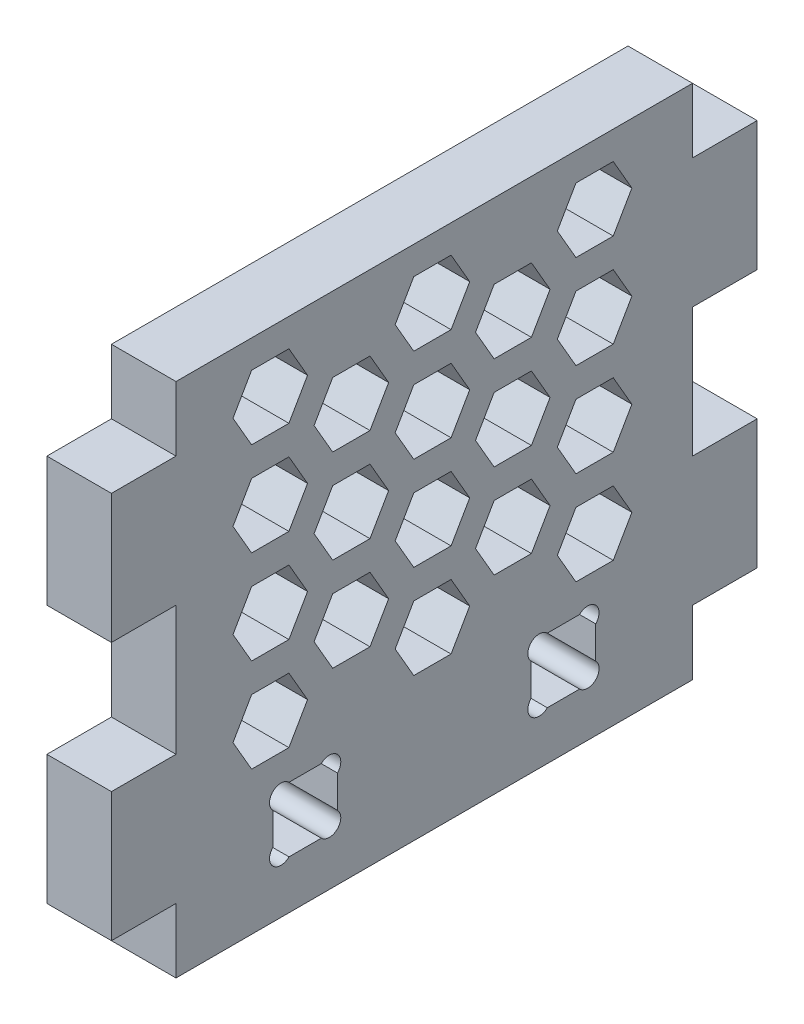
from build123d import *

# Parameters (mm, degrees)
SKETCH3_W                 = 101.6
SKETCH3_H                 = 101.6
SQUARE_EXTRUSION_DEPTH    = 12.7
SKETCH4_R                 = 2.24536
SKETCH4_W                 = 12.7
SKETCH4_H                 = 12.7
SLOTTING_HOLES_DEPTH      = 12.7
HONEYCOMB_POCKETING_DEPTH = 12.7
SKETCH10_W                = 12.7
SKETCH10_H                = 12.7
SIDE_SLOTS_DEPTH          = 12.7


with BuildPart() as part:
    # Sketch3 → Square Extrusion (new body)
    with BuildSketch(Plane(origin=(0, 0, 0), x_dir=(0, 0, -1), z_dir=(1, 0, 0))):
        Rectangle(SKETCH3_W, SKETCH3_H)
    extrude(amount=SQUARE_EXTRUSION_DEPTH)

    # Sketch4 → Slotting Holes (cut)
    with BuildSketch(Plane(origin=(12.7, 0, 0), x_dir=(0, 0, -1), z_dir=(1, 0, 0))):
        with BuildLine():
            ThreePointArc((-28.574581463, -28.575), (-31.750209282, -28.574790718), (-31.75, -31.750418537))
            Line((-31.75, -31.750418537), (-31.75, -28.575))
            Line((-31.75, -28.575), (-28.574581463, -28.575))
        make_face()
        with BuildLine():
            Line((-31.75, -28.575), (-31.75, -31.750418537))
            ThreePointArc((-31.75, -31.750418537), (-29.303101219, -32.236885515), (-27.91714, -30.1625))
            ThreePointArc((-27.91714, -30.1625), (-28.08800123, -29.303374641), (-28.574581463, -28.575))
            Line((-28.574581463, -28.575), (-31.75, -28.575))
        make_face()
        with Locations((-30.1625, -39.6875)):
            Circle(SKETCH4_R)
        with Locations((-20.6375, -39.6875)):
            Circle(SKETCH4_R)
        with Locations((-20.6375, -30.1625)):
            Circle(SKETCH4_R)
        with Locations((-30.1625, -30.1625)):
            Circle(SKETCH4_R)
        with Locations((-25.4, -34.925)):
            Rectangle(SKETCH4_W, SKETCH4_H)
        with BuildLine():
            ThreePointArc((-22.225418537, -28.575), (-22.225209282, -31.750209282), (-19.05, -31.750418537))
            Line((-19.05, -31.750418537), (-19.05, -28.575))
            Line((-19.05, -28.575), (-22.225418537, -28.575))
        make_face()
        with BuildLine():
            Line((-19.05, -28.575), (-19.05, -31.750418537))
            ThreePointArc((-19.05, -31.750418537), (-18.563114485, -31.021898781), (-18.39214, -30.1625))
            ThreePointArc((-18.39214, -30.1625), (-19.778374641, -28.08800123), (-22.225418537, -28.575))
            Line((-22.225418537, -28.575), (-19.05, -28.575))
        make_face()
        with BuildLine():
            Line((-31.75, -38.099581463), (-31.75, -41.275))
            Line((-31.75, -41.275), (-28.574581463, -41.275))
            ThreePointArc((-28.574581463, -41.275), (-28.08800123, -40.546625359), (-27.91714, -39.6875))
            ThreePointArc((-27.91714, -39.6875), (-29.303101219, -37.613114485), (-31.75, -38.099581463))
        make_face()
        with BuildLine():
            Line((-28.574581463, -41.275), (-31.75, -41.275))
            Line((-31.75, -41.275), (-31.75, -38.099581463))
            ThreePointArc((-31.75, -38.099581463), (-31.750209282, -41.275209282), (-28.574581463, -41.275))
        make_face()
        with BuildLine():
            ThreePointArc((-19.05, -38.099581463), (-22.225209282, -38.099790718), (-22.225418537, -41.275))
            Line((-22.225418537, -41.275), (-19.05, -41.275))
            Line((-19.05, -41.275), (-19.05, -38.099581463))
        make_face()
        with BuildLine():
            Line((-19.05, -41.275), (-22.225418537, -41.275))
            ThreePointArc((-22.225418537, -41.275), (-19.778374641, -41.76199877), (-18.39214, -39.6875))
            ThreePointArc((-18.39214, -39.6875), (-18.563114485, -38.828101219), (-19.05, -38.099581463))
            Line((-19.05, -38.099581463), (-19.05, -41.275))
        make_face()
        with BuildLine():
            ThreePointArc((22.88286, -30.1625), (22.71199877, -29.303374641), (22.225418537, -28.575))
            Line((22.225418537, -28.575), (19.05, -28.575))
            Line((19.05, -28.575), (19.05, -31.750418537))
            ThreePointArc((19.05, -31.750418537), (21.496898781, -32.236885515), (22.88286, -30.1625))
        make_face()
        with BuildLine():
            Line((19.05, -28.575), (22.225418537, -28.575))
            ThreePointArc((22.225418537, -28.575), (19.049790718, -28.574790718), (19.05, -31.750418537))
            Line((19.05, -31.750418537), (19.05, -28.575))
        make_face()
        with Locations((30.1625, -30.1625)):
            Circle(SKETCH4_R)
        with Locations((20.6375, -30.1625)):
            Circle(SKETCH4_R)
        with Locations((20.6375, -39.6875)):
            Circle(SKETCH4_R)
        with Locations((30.1625, -39.6875)):
            Circle(SKETCH4_R)
        with Locations((25.4, -34.925)):
            Rectangle(SKETCH4_W, SKETCH4_H)
        with BuildLine():
            Line((31.75, -31.750418537), (31.75, -28.575))
            Line((31.75, -28.575), (28.574581463, -28.575))
            ThreePointArc((28.574581463, -28.575), (28.574790718, -31.750209282), (31.75, -31.750418537))
        make_face()
        with BuildLine():
            Line((28.574581463, -28.575), (31.75, -28.575))
            Line((31.75, -28.575), (31.75, -31.750418537))
            ThreePointArc((31.75, -31.750418537), (32.236885515, -31.021898781), (32.40786, -30.1625))
            ThreePointArc((32.40786, -30.1625), (31.021625359, -28.08800123), (28.574581463, -28.575))
        make_face()
        with BuildLine():
            ThreePointArc((32.40786, -39.6875), (32.236885515, -38.828101219), (31.75, -38.099581463))
            Line((31.75, -38.099581463), (31.75, -41.275))
            Line((31.75, -41.275), (28.574581463, -41.275))
            ThreePointArc((28.574581463, -41.275), (31.021625359, -41.76199877), (32.40786, -39.6875))
        make_face()
        with BuildLine():
            Line((31.75, -41.275), (31.75, -38.099581463))
            ThreePointArc((31.75, -38.099581463), (28.574790718, -38.099790718), (28.574581463, -41.275))
            Line((28.574581463, -41.275), (31.75, -41.275))
        make_face()
        with BuildLine():
            ThreePointArc((22.88286, -39.6875), (21.496898781, -37.613114485), (19.05, -38.099581463))
            Line((19.05, -38.099581463), (19.05, -41.275))
            Line((19.05, -41.275), (22.225418537, -41.275))
            ThreePointArc((22.225418537, -41.275), (22.71199877, -40.546625359), (22.88286, -39.6875))
        make_face()
        with BuildLine():
            Line((19.05, -41.275), (19.05, -38.099581463))
            ThreePointArc((19.05, -38.099581463), (19.049790718, -41.275209282), (22.225418537, -41.275))
            Line((22.225418537, -41.275), (19.05, -41.275))
        make_face()
    extrude(amount=-SLOTTING_HOLES_DEPTH, mode=Mode.SUBTRACT)

    # Sketch9 → Honeycomb Pocketing (cut)
    with BuildSketch(Plane(origin=(12.7, 0, 0), x_dir=(0, 0, -1), z_dir=(1, 0, 0))):
        Polygon((6.96765294, 38.931186014), (3.301476978, 45.281185003), (-4.03087144, 45.28118298), (-7.697043898, 38.931181968), (-4.030867936, 32.58118298), (3.301480483, 32.581185003), align=None)
        Polygon((-24.928062682, 38.931186014), (-28.594238643, 45.281185003), (-35.926587062, 45.28118298), (-39.592759519, 38.931181968), (-35.926583558, 32.58118298), (-28.594235139, 32.581185003), align=None)
        Polygon((38.863368561, 38.931186014), (35.1971926, 45.281185003), (27.864844181, 45.28118298), (24.198671724, 38.931181968), (27.864847685, 32.58118298), (35.197196104, 32.581185003), align=None)
        Polygon((-8.980204871, 29.723686014), (-12.646380832, 36.073685003), (-19.978729251, 36.07368298), (-23.644901708, 29.723681968), (-19.978725747, 23.37368298), (-12.646377328, 23.373685003), align=None)
        Polygon((22.769795129, 29.723686014), (19.103619168, 36.073685003), (11.771270749, 36.07368298), (8.105098292, 29.723681968), (11.771274253, 23.37368298), (19.103622672, 23.373685003), align=None)
        Polygon((-24.928062682, 20.516186014), (-28.594238643, 26.866185003), (-35.926587062, 26.86618298), (-39.592759519, 20.516181968), (-35.926583558, 14.16618298), (-28.594235139, 14.166185003), align=None)
        Polygon((6.96765294, 20.516186014), (3.301476978, 26.866185003), (-4.03087144, 26.86618298), (-7.697043898, 20.516181968), (-4.030867936, 14.16618298), (3.301480483, 14.166185003), align=None)
        Polygon((38.863368561, 20.516186014), (35.1971926, 26.866185003), (27.864844181, 26.86618298), (24.198671724, 20.516181968), (27.864847685, 14.16618298), (35.197196104, 14.166185003), align=None)
        Polygon((-24.928062682, 2.101186014), (-28.594238643, 8.451185003), (-35.926587062, 8.45118298), (-39.592759519, 2.101181968), (-35.926583558, -4.24881702), (-28.594235139, -4.248814997), align=None)
        Polygon((-8.980204871, -7.106313986), (-12.646380832, -0.756314997), (-19.978729251, -0.75631702), (-23.644901708, -7.106318032), (-19.978725747, -13.45631702), (-12.646377328, -13.456314997), align=None)
        Polygon((6.96765294, 2.101186014), (3.301476978, 8.451185003), (-4.03087144, 8.45118298), (-7.697043898, 2.101181968), (-4.030867936, -4.24881702), (3.301480483, -4.248814997), align=None)
        Polygon((22.769795129, -7.106313986), (19.103619168, -0.756314997), (11.771270749, -0.75631702), (8.105098292, -7.106318032), (11.771274253, -13.45631702), (19.103622672, -13.456314997), align=None)
        Polygon((38.863368561, 2.101186014), (35.1971926, 8.451185003), (27.864844181, 8.45118298), (24.198671724, 2.101181968), (27.864847685, -4.24881702), (35.197196104, -4.248814997), align=None)
        Polygon((38.863368561, -16.313813986), (35.1971926, -9.963814997), (27.864844181, -9.96381702), (24.198671724, -16.313818032), (27.864847685, -22.66381702), (35.197196104, -22.663814997), align=None)
        Polygon((6.96765294, -16.313813986), (3.301476978, -9.963814997), (-4.03087144, -9.96381702), (-7.697043898, -16.313818032), (-4.030867936, -22.66381702), (3.301480483, -22.663814997), align=None)
        Polygon((-24.928062682, -16.313813986), (-28.594238643, -9.963814997), (-35.926587062, -9.96381702), (-39.592759519, -16.313818032), (-35.926583558, -22.66381702), (-28.594235139, -22.663814997), align=None)
        Polygon((22.769795129, 11.308686014), (19.103619168, 17.658685003), (11.771270749, 17.65868298), (8.105098292, 11.308681968), (11.771274253, 4.95868298), (19.103622672, 4.958685003), align=None)
        Polygon((-8.980204871, 11.308686014), (-12.646380832, 17.658685003), (-19.978729251, 17.65868298), (-23.644901708, 11.308681968), (-19.978725747, 4.95868298), (-12.646377328, 4.958685003), align=None)
    extrude(amount=-HONEYCOMB_POCKETING_DEPTH, mode=Mode.SUBTRACT)

    # Sketch10 → Side Slots (add)
    with BuildSketch(Plane(origin=(12.7, 0, 0), x_dir=(0, 0, -1), z_dir=(1, 0, 0))):
        with Locations((-57.15, 31.75)):
            Rectangle(SKETCH10_W, SKETCH10_H)
        with Locations((-57.15, 19.05)):
            Rectangle(SKETCH10_W, SKETCH10_H)
        with Locations((-57.15, -19.05)):
            Rectangle(SKETCH10_W, SKETCH10_H)
        with Locations((-57.15, -31.75)):
            Rectangle(SKETCH10_W, SKETCH10_H)
        with Locations((57.15, -19.05)):
            Rectangle(SKETCH10_W, SKETCH10_H)
        with Locations((57.15, -31.75)):
            Rectangle(SKETCH10_W, SKETCH10_H)
        with Locations((57.15, 19.05)):
            Rectangle(SKETCH10_W, SKETCH10_H)
        with Locations((57.15, 31.75)):
            Rectangle(SKETCH10_W, SKETCH10_H)
    extrude(amount=-SIDE_SLOTS_DEPTH)


solid = part.part
